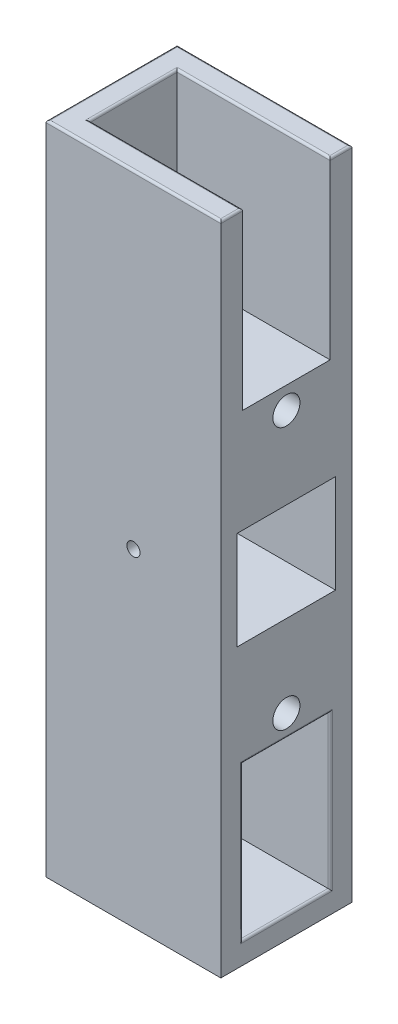
from build123d import *

# Parameters (mm, degrees)
BOSS_EXTRUDE1_DEPTH      = 75
BOSS_EXTRUDE1_DEPTH_BACK = 75
SKETCH1_W                = 40
SKETCH1_H                = 30
SKETCH3_R                = 3.1
CUT_EXTRUDE1_DEPTH       = 150
CUT_EXTRUDE2_DEPTH       = 150
CUT_EXTRUDE2_DEPTH_BACK  = 150
SKETCH4_W                = 22.5
SKETCH4_H                = 22.5
SKETCH7_W                = 58.590655802
SKETCH7_H                = 20
CUT_EXTRUDE5_DEPTH       = 40
SKETCH8_W                = 20
SKETCH8_H                = 35
CUT_EXTRUDE6_DEPTH       = 35
FILLET2_R                = 0.5
FILLET3_R                = 0.5
CUT_EXTRUDE7_DEPTH       = 102
CUT_EXTRUDE7_DEPTH_BACK  = 10
SKETCH6_R                = 1.5


with BuildPart() as part:
    # Sketch1 → Boss-Extrude1 (new, two sides: drawn at the far end of the back side and taken through both)
    with BuildSketch(Plane(origin=(0, 0, 0), x_dir=(1, 0, 0), z_dir=(0, 1, 0)).offset(-BOSS_EXTRUDE1_DEPTH_BACK)):
        Rectangle(SKETCH1_W, SKETCH1_H)
    extrude(amount=BOSS_EXTRUDE1_DEPTH + BOSS_EXTRUDE1_DEPTH_BACK)

    # Sketch3 → Cut-Extrude1 (cut)
    with BuildSketch(Plane(origin=(20, 0, 0), x_dir=(0, 0, -1), z_dir=(1, 0, 0))):
        with Locations((0, 30)):
            Circle(SKETCH3_R)
    cut_extrude1 = extrude(amount=-CUT_EXTRUDE1_DEPTH, mode=Mode.SUBTRACT)

    # Mirror1: Cut-Extrude1 across plane
    add(cut_extrude1.mirror(Plane.ZX), mode=Mode.SUBTRACT)

    # Sketch4 → Cut-Extrude2 (cut, two sides: drawn at the far end of the back side and taken through both)
    with BuildSketch(Plane(origin=(0, 0, 0), x_dir=(0, 0, -1), z_dir=(1, 0, 0)).offset(-CUT_EXTRUDE2_DEPTH_BACK)):
        Rectangle(SKETCH4_W, SKETCH4_H)
    extrude(amount=CUT_EXTRUDE2_DEPTH + CUT_EXTRUDE2_DEPTH_BACK, mode=Mode.SUBTRACT)

    # Sketch7 → Cut-Extrude5 (cut)
    with BuildSketch(Plane(origin=(0, 75, 0), x_dir=(1, 0, 0), z_dir=(0, 1, 0))):
        with Locations((14.295327901, 0)):
            Rectangle(SKETCH7_W, SKETCH7_H)
    extrude(amount=-CUT_EXTRUDE5_DEPTH, mode=Mode.SUBTRACT)

    # Sketch8 → Cut-Extrude6 (cut)
    with BuildSketch(Plane(origin=(20, 0, 0), x_dir=(0, 0, -1), z_dir=(1, 0, 0))):
        with Locations((0, -52.5)):
            Rectangle(SKETCH8_W, SKETCH8_H)
    extrude(amount=-CUT_EXTRUDE6_DEPTH, mode=Mode.SUBTRACT)

    # Fillet2
    fillet2_edges = [part.edges().sort_by_distance(p)[0] for p in [
        (20, 75, -12.5),
        (2.5, 75, -10),
        (-15, 75, 0),
        (2.5, 75, 10),
        (20, 75, 12.5),
        (0, 75, -15),
        (-20, 75, 0),
        (0, 75, 15),
    ]]
    fillet(fillet2_edges, radius=FILLET2_R)

    # Fillet3
    fillet3_edges = [part.edges().sort_by_distance(p)[0] for p in [
        (20, -70, 0),
        (20, -52.5, 10),
        (20, -35, 0),
        (20, -52.5, -10),
    ]]
    fillet(fillet3_edges, radius=FILLET3_R)

    # Sketch6 → Cut-Extrude7 (cut, two sides: drawn at the far end of the back side and taken through both)
    with BuildSketch(Plane(origin=(0, 0, 11.25), x_dir=(-1, 0, 0), z_dir=(0, 0, -1)).offset(-CUT_EXTRUDE7_DEPTH_BACK)):
        Circle(SKETCH6_R)
    extrude(amount=CUT_EXTRUDE7_DEPTH + CUT_EXTRUDE7_DEPTH_BACK, mode=Mode.SUBTRACT)


solid = part.part
